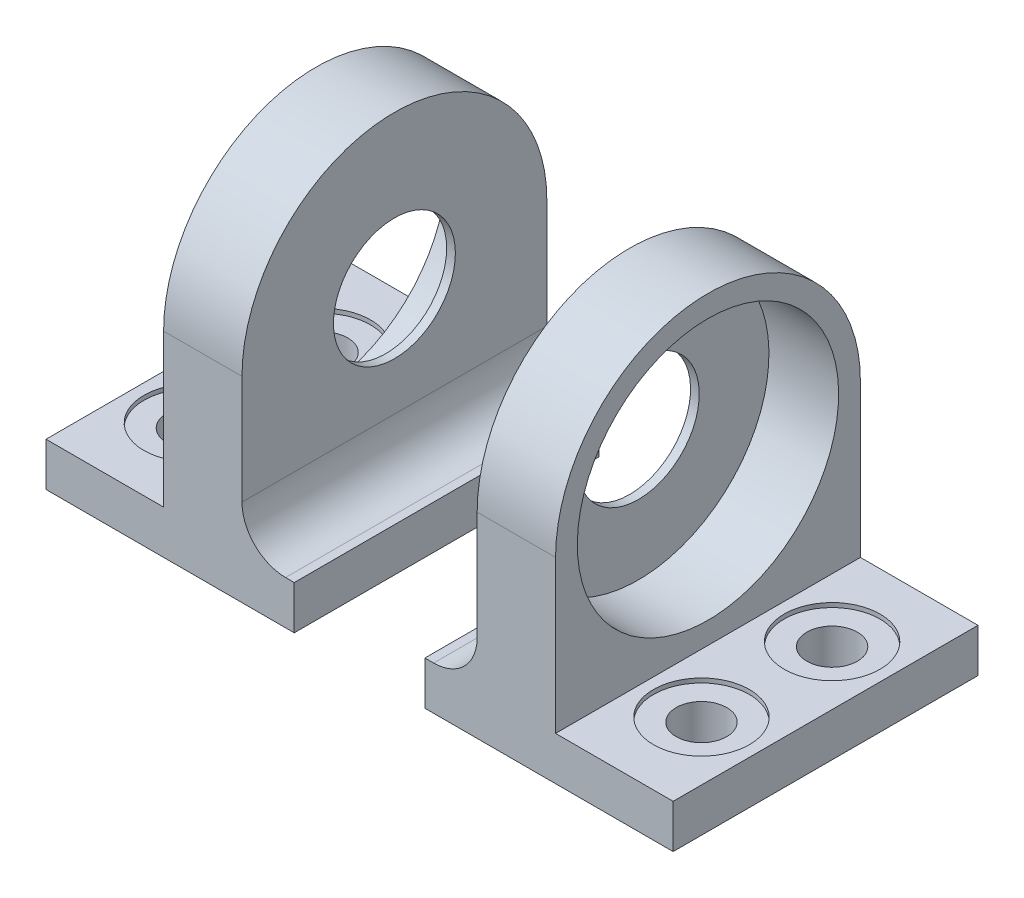
from build123d import *

# Parameters (mm, degrees)
EXTRUDE_2_DEPTH            = 35
EXTRUDE_2_2_DEPTH          = 35
CUT_EXTRUDE_11_DEPTH       = 9
CUT_EXTRUDE_12_DEPTH       = 9
SKETCH_6_R                 = 15
CUT_EXTRUDE_13_DEPTH       = 8
CUT_EXTRUDE_START          = -8
SKETCH_7_R                 = 15
CUT_EXTRUDE_15_DEPTH       = 8
SKETCH_16_R                = 7
CUT_EXTRUDE_18_DEPTH       = 1
SKETCH_17_R                = 7
CUT_EXTRUDE_19_DEPTH       = 1
HOLE_WIZARD_C_1_AT_2_COUNT = 2
HOLE_WIZARD_C_1_AT_2_PITCH = 15
HOLE_WIZARD_C_1_AT_3_COUNT = 2
HOLE_WIZARD_C_1_AT_3_PITCH = 58.5
HOLE_WIZARD_C_1_AT_4_COUNT = 2
HOLE_WIZARD_C_1_AT_4_PITCH = 60.392466418
FILLET_3_R                 = 5
FILLET_4_R                 = 5


with BuildPart() as part:
    # 草图2 → 凸台-拉伸2 (new body)
    with BuildSketch(Plane.XY):
        Polygon((0, 0), (-8.062518271, 0), (-22.5, 0), (-22.5, 5), (-9, 5), (-9, 40), (0, 40), (0, 5), (6, 5), (6, 0), align=None)
    extrude(amount=EXTRUDE_2_DEPTH)

    # 草图5 → 切除-拉伸12 (cut)
    with BuildSketch(Plane.ZY.offset(9)):
        with BuildLine():
            Line((0, 40), (0, 22.5))
            ThreePointArc((0, 22.5), (5.125631329, 34.874368671), (17.5, 40))
            Line((17.5, 40), (0, 40))
        make_face()
        with BuildLine():
            ThreePointArc((17.5, 40), (29.874368671, 34.874368671), (35, 22.5))
            Line((35, 22.5), (35, 40))
            Line((35, 40), (17.5, 40))
        make_face()
    extrude(amount=-CUT_EXTRUDE_12_DEPTH, mode=Mode.SUBTRACT)

    # 草图6 → 切除-拉伸13 (cut)
    with BuildSketch(Plane.ZY.offset(9)):
        with Locations((17.5, 22.5)):
            Circle(SKETCH_6_R)
    extrude(amount=-CUT_EXTRUDE_13_DEPTH, mode=Mode.SUBTRACT)

    # 草图17 → 切除-拉伸19 (cut)
    with BuildSketch(Plane(origin=(0, 0, 0), x_dir=(0, 0, -1), z_dir=(1, 0, 0))):
        with Locations((-17.5, 22.5)):
            Circle(SKETCH_17_R)
    extrude(amount=-CUT_EXTRUDE_19_DEPTH, mode=Mode.SUBTRACT)

    # 草图20 → 打孔尺寸(%根据六角头螺)栓 C 级的类型1 (revolve, cut)
    with BuildSketch(Plane(origin=(-15.75, 5, 10), x_dir=(0, 0, 1), z_dir=(1, 0, 0))):
        Polygon((0, 0), (0, 6.742495795), (2.9, 5), (2.9, 0.5), (5.5, 0.5), (5.5, 0), align=None)
    hole_wizard_c_1 = revolve(axis=Axis((-15.75, 11.35, 10), (0, -1, 0)), mode=Mode.SUBTRACT)

    # 打孔尺寸(%根据六角头螺)栓 C 级的类型1 at 2: 打孔尺寸(%根据六角头螺)栓 C 级的类型1 ×2
    with Locations(*[(0, 0, i * HOLE_WIZARD_C_1_AT_2_PITCH) for i in range(1, HOLE_WIZARD_C_1_AT_2_COUNT)]):
        add(hole_wizard_c_1, mode=Mode.SUBTRACT)

    # 圆角4
    fillet_4_edges = [part.edges().sort_by_distance(p)[0] for p in [
        (0, 5, 17.5),
    ]]
    fillet(fillet_4_edges, radius=FILLET_4_R)


with BuildPart() as body_2:
    # 草图2 → Extrude 2 2 (new body)
    with BuildSketch(Plane.XY):
        Polygon((49.5, 0), (49.5, 5), (36, 5), (36, 40), (27, 40), (27, 5), (21, 5), (21, 0), (27, 0), (35.062518271, 0), align=None)
    extrude(amount=EXTRUDE_2_2_DEPTH)

    # 草图4 → 切除-拉伸11 (cut)
    with BuildSketch(Plane(origin=(36, 0, 0), x_dir=(0, 0, -1), z_dir=(1, 0, 0))):
        with BuildLine():
            Line((-35, 40), (-35, 22.5))
            ThreePointArc((-35, 22.5), (-29.874368671, 34.874368671), (-17.5, 40))
            Line((-17.5, 40), (-35, 40))
        make_face()
        with BuildLine():
            ThreePointArc((-17.5, 40), (-5.125631329, 34.874368671), (0, 22.5))
            Line((0, 22.5), (0, 40))
            Line((0, 40), (-17.5, 40))
        make_face()
    extrude(amount=-CUT_EXTRUDE_11_DEPTH, mode=Mode.SUBTRACT)

    # 草图7 → 切除-拉伸15 (cut)
    with BuildSketch(Plane(origin=(36, 0, 0), x_dir=(0, 0, -1), z_dir=(1, 0, 0)).offset(CUT_EXTRUDE_START)):
        with Locations((-17.5, 22.5)):
            Circle(SKETCH_7_R)
    extrude(amount=CUT_EXTRUDE_15_DEPTH, mode=Mode.SUBTRACT)

    # 草图16 → 切除-拉伸18 (cut)
    with BuildSketch(Plane.ZY.offset(-27)):
        with Locations((17.5, 22.5)):
            Circle(SKETCH_16_R)
    extrude(amount=-CUT_EXTRUDE_18_DEPTH, mode=Mode.SUBTRACT)

    # 打孔尺寸(%根据六角头螺)栓 C 级的类型1 at 3: 打孔尺寸(%根据六角头螺)栓 C 级的类型1 ×2
    with Locations(*[(i * HOLE_WIZARD_C_1_AT_3_PITCH, 0, 0) for i in range(1, HOLE_WIZARD_C_1_AT_3_COUNT)]):
        add(hole_wizard_c_1, mode=Mode.SUBTRACT)

    # 打孔尺寸(%根据六角头螺)栓 C 级的类型1 at 4: 打孔尺寸(%根据六角头螺)栓 C 级的类型1 ×2
    with Locations(*[Vector(0.968663866044045, 0, 0.24837535026770385) * (i * HOLE_WIZARD_C_1_AT_4_PITCH) for i in range(1, HOLE_WIZARD_C_1_AT_4_COUNT)]):
        add(hole_wizard_c_1, mode=Mode.SUBTRACT)

    # 圆角3
    fillet_3_edges = [body_2.edges().sort_by_distance(p)[0] for p in [
        (27, 5, 17.5),
    ]]
    fillet(fillet_3_edges, radius=FILLET_3_R)


solid = Compound([part.part, body_2.part])
